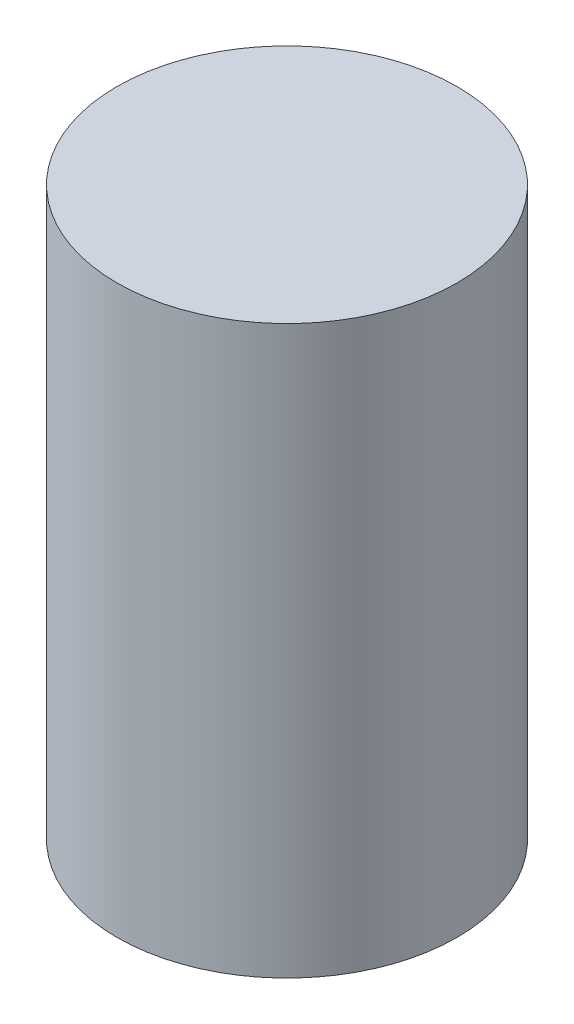
from build123d import *

# Parameters (mm, degrees)
CROQUIS_PERFIL_W           = 30
CROQUIS_PERFIL_H           = 100
CROQUIS_AGUJEROS_MONTAJE_R = 4
AGUJERO_INSERTO_M6_DEPTH   = 14


with BuildPart() as part:
    # Croquis_perfil → Cilindro_D60x100 (revolve)
    with BuildSketch(Plane.XY, mode=Mode.PRIVATE) as cilindro_d60x100_sk:
        with Locations((15, 50)):
            Rectangle(CROQUIS_PERFIL_W, CROQUIS_PERFIL_H)
    revolve(cilindro_d60x100_sk.sketch.rotate(Axis((0, 0, 0), (0, 1, 0)), 90), axis=Axis((0, 0, 0), (0, 1, 0)))

    # Croquis_agujeros_montaje → Agujero_inserto_M6 (cut)
    with BuildSketch(Plane(origin=(0, 0, 0), x_dir=(1, 0, 0), z_dir=(0, 1, 0))):
        with Locations(Location((0, 0, 0), (0, 0, 270))):
            Circle(CROQUIS_AGUJEROS_MONTAJE_R)
    extrude(amount=AGUJERO_INSERTO_M6_DEPTH, mode=Mode.SUBTRACT)


solid = part.part
